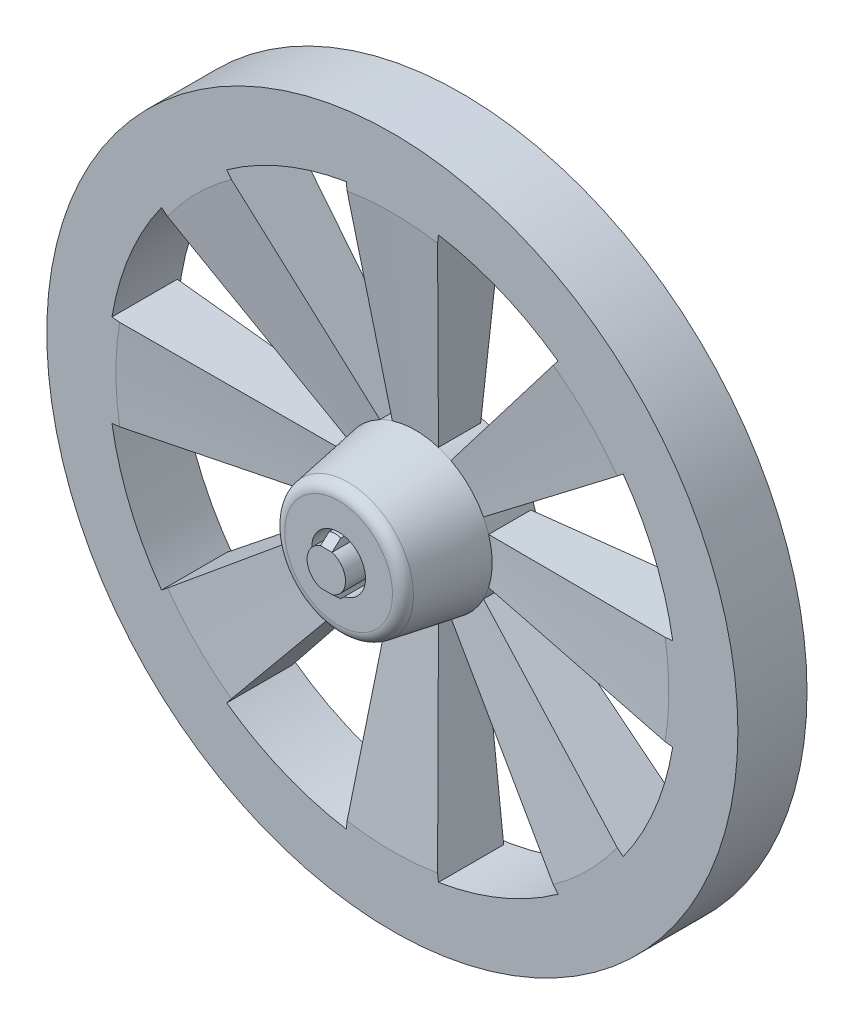
from build123d import *

# Parameters (mm, degrees)
SKETCH1_R               = 571.5
SKETCH1_R_2             = 469.9
BOSS_EXTRUDE1_DEPTH     = 114.3
BOSS_EXTRUDE2_START     = -107.95
BOSS_EXTRUDE2_DEPTH     = 107.95
CIRPATTERN2_COUNT       = 8
SKETCH18_R              = 457.217714823
SKETCH17_R              = 127
SKETCH9_R               = 127
BOSS_EXTRUDE4_DEPTH     = 76.2
SKETCH10_R              = 127
BOSS_EXTRUDE6_DEPTH     = 127
BOSS_EXTRUDE6_TAPER     = 9.74
FILLET1_R               = 19.05
SKETCH13_R              = 44.45
CUT_EXTRUDE2_DEPTH      = 50.8
BOSS_EXTRUDE9_START     = 71.12
BOSS_EXTRUDE9_DEPTH     = 71.12
CUT_EXTRUDE3_DEPTH      = 71.12
CUT_EXTRUDE3_DEPTH_BACK = 71.12
SKETCH19_R              = 63.5
CUT_EXTRUDE4_DEPTH      = 25.4


with BuildPart() as part:
    # Sketch1 → Boss-Extrude1 (new body)
    with BuildSketch(Plane.XY):
        Circle(SKETCH1_R)
        Circle(SKETCH1_R_2, mode=Mode.SUBTRACT)
    extrude(amount=BOSS_EXTRUDE1_DEPTH)

    # Sketch2 → Boss-Extrude2 (add)
    with BuildSketch(Plane.XY.offset(114.3).offset(BOSS_EXTRUDE2_START)):
        with BuildLine():
            ThreePointArc((76.2, 463.680461094), (0, 469.9), (-76.2, 463.680461094))
            Line((-76.2, 463.680461094), (-38.1, 121.15027858))
            ThreePointArc((-38.1, 121.15027858), (0, 127), (38.1, 121.15027858))
            Line((38.1, 121.15027858), (76.2, 463.680461094))
        make_face()
    boss_extrude2 = extrude(amount=BOSS_EXTRUDE2_DEPTH)

    # CirPattern2: Boss-Extrude2 ×8 about axis
    cirpattern2_axis = Axis((0, 0, 0), (0, 0, 1))
    for i in range(1, CIRPATTERN2_COUNT):
        add(boss_extrude2.rotate(cirpattern2_axis, i * 360 / CIRPATTERN2_COUNT))

    # Sketch18 → Cut-Loft1 section 0
    with BuildSketch(Plane.XY.offset(114.3)):
        Circle(SKETCH18_R)
    # Sketch17 → Cut-Loft1 section 1
    with BuildSketch(Plane.XY.offset(76.2)):
        Circle(SKETCH17_R)
    loft(mode=Mode.SUBTRACT)

    # Sketch9 → Boss-Extrude4 (add)
    with BuildSketch(Plane.XY):
        with Locations(Location((0, 0, 0), (0, 0, 162.542396876))):
            Circle(SKETCH9_R)
    extrude(amount=BOSS_EXTRUDE4_DEPTH)

    # Sketch10 → Boss-Extrude6 (add)
    with BuildSketch(Plane.XY.offset(76.2)):
        with Locations(Location((0, 0, 0), (0, 0, 162.542396876))):
            Circle(SKETCH10_R)
    extrude(amount=BOSS_EXTRUDE6_DEPTH, taper=BOSS_EXTRUDE6_TAPER)

    # Fillet1
    fillet1_edges = [part.edges().sort_by_distance(p)[0] for p in [
        (100.35462173, -31.560068477, 203.2),
    ]]
    fillet(fillet1_edges, radius=FILLET1_R)

    # Sketch13 → Cut-Extrude2 (cut)
    with BuildSketch(Plane.XY.offset(203.2)):
        Circle(SKETCH13_R)
    extrude(amount=-CUT_EXTRUDE2_DEPTH, mode=Mode.SUBTRACT)

    # Sketch15 → Boss-Extrude9 (add)
    with BuildSketch(Plane.XY.offset(152.4).offset(BOSS_EXTRUDE9_START)):
        with BuildLine():
            Line((-9.525, 43.417472001), (-9.525, 30.287569645))
            ThreePointArc((-9.525, 30.287569645), (-31.75, 0), (-9.525, -30.287569645))
            Line((-9.525, -30.287569645), (-9.525, -43.417472001))
            ThreePointArc((-9.525, -43.417472001), (0, -44.45), (9.525, -43.417472001))
            Line((9.525, -43.417472001), (9.525, -30.287569645))
            ThreePointArc((9.525, -30.287569645), (31.75, 0), (9.525, 30.287569645))
            Line((9.525, 30.287569645), (9.525, 43.417472001))
            ThreePointArc((9.525, 43.417472001), (0, 44.45), (-9.525, 43.417472001))
        make_face()
    extrude(amount=-BOSS_EXTRUDE9_DEPTH)

    # Sketch16 → Cut-Extrude3 (cut, two sides: drawn at the far end of the back side and taken through both)
    with BuildSketch(Plane(origin=(0, 0, 0), x_dir=(0, 0, -1), z_dir=(1, 0, 0)).offset(-CUT_EXTRUDE3_DEPTH_BACK)):
        Polygon((-223.52, 30.287569645), (-208.28, 44.45), (-223.52, 44.45), align=None)
        Polygon((-223.52, -44.45), (-223.52, -30.287569645), (-208.28, -44.45), align=None)
    extrude(amount=CUT_EXTRUDE3_DEPTH + CUT_EXTRUDE3_DEPTH_BACK, mode=Mode.SUBTRACT)

    # Sketch19 → Cut-Extrude4 (cut)
    with BuildSketch(Plane(origin=(0, 0, 0), x_dir=(-1, 0, 0), z_dir=(0, 0, -1))):
        Circle(SKETCH19_R)
    extrude(amount=-CUT_EXTRUDE4_DEPTH, mode=Mode.SUBTRACT)


solid = part.part
